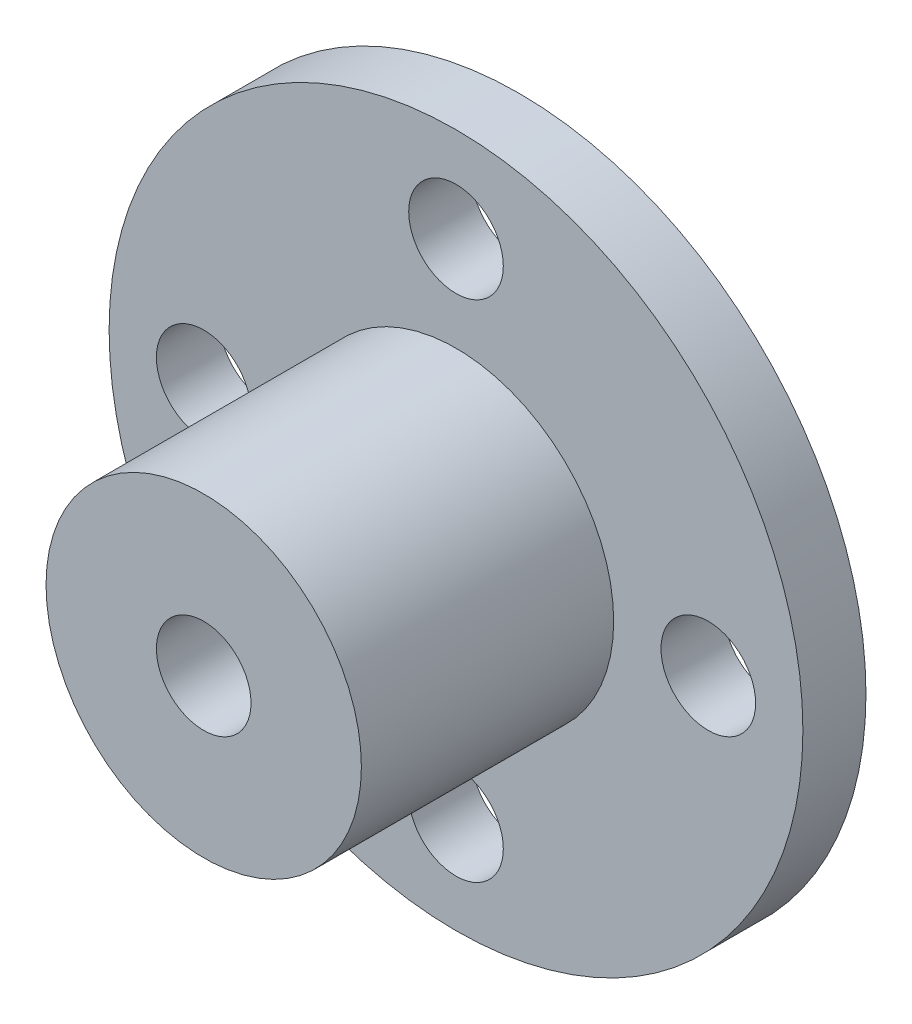
from build123d import *

# Parameters (mm, degrees)
SKETCH1_R      = 11
EXTRUDE1_DEPTH = 2
SKETCH2_R      = 5
EXTRUDE2_DEPTH = 8
SKETCH3_R      = 1.5
EXTRUDE5_DEPTH = 19.493242009
SKETCH4_R      = 1.5
EXTRUDE6_DEPTH = 8


with BuildPart() as part:
    # Sketch1 → Extrude1 (new body)
    with BuildSketch(Plane.XY):
        Circle(SKETCH1_R)
    extrude(amount=EXTRUDE1_DEPTH)

    # Sketch2 → Extrude2 (add)
    with BuildSketch(Plane.XY.offset(2)):
        Circle(SKETCH2_R)
    extrude(amount=EXTRUDE2_DEPTH)

    # Sketch3 → Extrude5 (cut, through all)
    with BuildSketch(Plane.XY):
        Circle(SKETCH3_R)
    extrude(amount=EXTRUDE5_DEPTH, mode=Mode.SUBTRACT)

    # Sketch4 → Extrude6 (cut)
    with BuildSketch(Plane(origin=(0, 0, 0), x_dir=(-1, 0, 0), z_dir=(0, 0, -1))):
        with Locations((8, 0)):
            Circle(SKETCH4_R)
        with Locations((0, -8)):
            Circle(SKETCH4_R)
        with Locations((-8, 0)):
            Circle(SKETCH4_R)
        with Locations((0, 8)):
            Circle(SKETCH4_R)
    extrude(amount=-EXTRUDE6_DEPTH, mode=Mode.SUBTRACT)


solid = part.part
